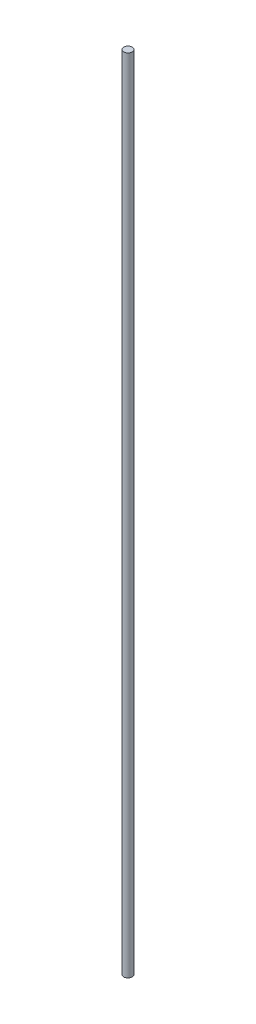
from build123d import *

# Parameters (mm, degrees)
SKETCH_1_R      = 8
EXTRUDE_1_DEPTH = 1500


with BuildPart() as part:
    # ｽｹｯﾁ1 → ﾎﾞｽ - 押し出し1 (new body)
    with BuildSketch(Plane(origin=(0, 0, 0), x_dir=(1, 0, 0), z_dir=(0, 1, 0))):
        with Locations(Location((0, 0, 0), (0, 0, 270))):
            Circle(SKETCH_1_R)
    extrude(amount=EXTRUDE_1_DEPTH)


solid = part.part
